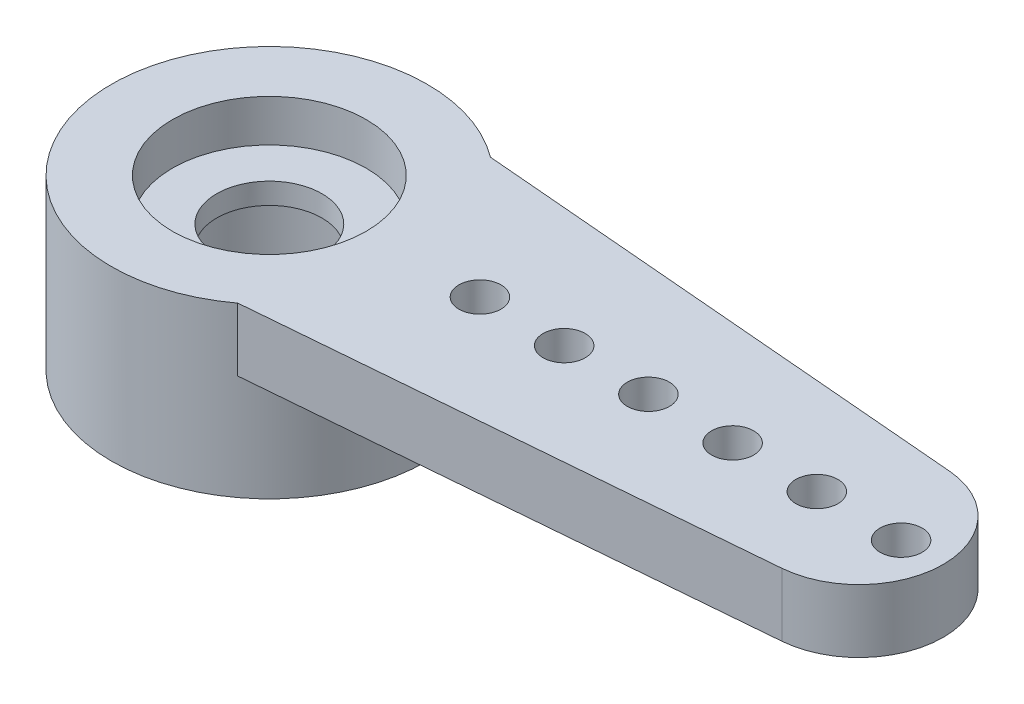
from build123d import *

# Parameters (mm, degrees)
SKETCH1_R           = 3.75
BOSS_EXTRUDE1_DEPTH = 4
SKETCH2_R           = 2.3
CUT_EXTRUDE1_DEPTH  = 1
BOSS_EXTRUDE2_START = -1.5
SKETCH3_R           = 0.5
BOSS_EXTRUDE2_DEPTH = 1.5
SKETCH4_R           = 1.25
CUT_EXTRUDE2_DEPTH  = 4.5
CUT_EXTRUDE3_START  = -2.5
SKETCH5_R           = 2.3
CUT_EXTRUDE3_DEPTH  = 2.5


with BuildPart() as part:
    # Sketch1 → Boss-Extrude1 (new body)
    with BuildSketch(Plane(origin=(0, 0, 0), x_dir=(1, 0, 0), z_dir=(0, 1, 0))):
        Circle(SKETCH1_R)
    extrude(amount=BOSS_EXTRUDE1_DEPTH)

    # Sketch2 → Cut-Extrude1 (cut)
    with BuildSketch(Plane(origin=(0, 4, 0), x_dir=(1, 0, 0), z_dir=(0, 1, 0))):
        Circle(SKETCH2_R)
    extrude(amount=-CUT_EXTRUDE1_DEPTH, mode=Mode.SUBTRACT)

    # Sketch3 → Boss-Extrude2 (add)
    with BuildSketch(Plane(origin=(0, 4, 0), x_dir=(1, 0, 0), z_dir=(0, 1, 0)).offset(BOSS_EXTRUDE2_START)):
        with BuildLine():
            Line((14.168399438, -1.992897797), (2.25, -3))
            ThreePointArc((2.25, -3), (3.75, 0), (2.25, 3))
            Line((2.25, 3), (14.168399438, 1.992897797))
            ThreePointArc((14.168399438, 1.992897797), (16, 0), (14.168399438, -1.992897797))
        make_face()
        with Locations((15, 0)):
            Circle(SKETCH3_R, mode=Mode.SUBTRACT)
        with Locations((5, 0)):
            Circle(SKETCH3_R, mode=Mode.SUBTRACT)
        with Locations((7, 0)):
            Circle(SKETCH3_R, mode=Mode.SUBTRACT)
        with Locations((9, 0)):
            Circle(SKETCH3_R, mode=Mode.SUBTRACT)
        with Locations((11, 0)):
            Circle(SKETCH3_R, mode=Mode.SUBTRACT)
        with Locations((13, 0)):
            Circle(SKETCH3_R, mode=Mode.SUBTRACT)
    extrude(amount=BOSS_EXTRUDE2_DEPTH)

    # Sketch4 → Cut-Extrude2 (cut)
    with BuildSketch(Plane(origin=(0, 3, 0), x_dir=(1, 0, 0), z_dir=(0, 1, 0))):
        Circle(SKETCH4_R)
    extrude(amount=-CUT_EXTRUDE2_DEPTH, mode=Mode.SUBTRACT)

    # Sketch5 → Cut-Extrude3 (cut)
    with BuildSketch(Plane.XZ.offset(CUT_EXTRUDE3_START)):
        Circle(SKETCH5_R)
    extrude(amount=CUT_EXTRUDE3_DEPTH, mode=Mode.SUBTRACT)


solid = part.part
